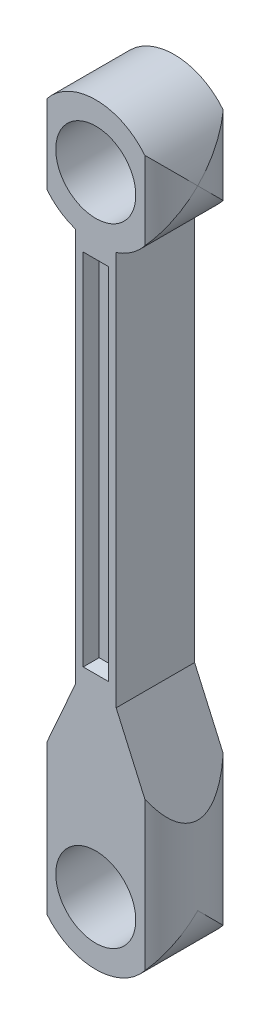
from build123d import *

# Parameters (mm, degrees)
SKETCH1_R               = 6.477
BOSS_EXTRUDE1_DEPTH     = 12.7
SKETCH2_W               = 4.064
SKETCH2_H               = 58.166
CUT_EXTRUDE1_DEPTH      = 2.032
CUT_EXTRUDE1_DRAFT      = -15
SKETCH3_W               = 4.064
SKETCH3_H               = 58.166
CUT_EXTRUDE2_DEPTH      = 2.032
CUT_EXTRUDE2_DRAFT      = -15
CUT_EXTRUDE3_DEPTH      = 113.937209103
CUT_EXTRUDE3_DEPTH_BACK = 10.16
SKETCH4_OUTSIDE_W       = 47.17
SKETCH4_OUTSIDE_H       = 39.55
SKETCH4_OUTSIDE_R       = 10.16


with BuildPart() as part:
    # Sketch1 → Boss-Extrude1 (new body)
    with BuildSketch(Plane.XY):
        with BuildLine():
            Line((-10.16, 0), (-10.16, 12.7))
            Line((-10.16, 12.7), (-3.302, 28.175956627))
            Line((-3.302, 28.175956627), (-3.302, 91.991545598))
            ThreePointArc((-3.302, 91.991545598), (0, 111.76), (3.302, 91.991545598))
            Line((3.302, 91.991545598), (3.302, 28.175956627))
            Line((3.302, 28.175956627), (10.16, 12.7))
            Line((10.16, 12.7), (10.16, 0))
            ThreePointArc((10.16, 0), (0, -10.16), (-10.16, 0))
        make_face()
        with Locations(Location((0, 0, 0), (0, 0, 180))):
            Circle(SKETCH1_R, mode=Mode.SUBTRACT)
        with Locations(Location((0, 101.6, 0), (0, 0, 180))):
            Circle(SKETCH1_R, mode=Mode.SUBTRACT)
    extrude(amount=BOSS_EXTRUDE1_DEPTH)


with BuildPart() as cut_extrude1_tool:
    # Sketch2 → Cut-Extrude1 (with draft: the straight prism first)
    with BuildSketch(Plane.XY.offset(12.7)):
        with Locations((0, 60.325)):
            Rectangle(SKETCH2_W, SKETCH2_H)
    extrude(amount=-CUT_EXTRUDE1_DEPTH)
    # Cut-Extrude1: the draft: its side faces are tilted about the plane it starts from
    cut_extrude1_sides = [cut_extrude1_tool.faces().sort_by_distance(p)[0] for p in [
        (-2.032, 60.325, 11.684),
        (0, 31.242, 11.684),
        (2.032, 60.325, 11.684),
        (0, 89.408, 11.684),
    ]]
    draft(cut_extrude1_sides, Plane.XY.offset(12.7), CUT_EXTRUDE1_DRAFT)


with BuildPart() as part_1:
    add(part.part)

    # Cut-Extrude1: cut by cut_extrude1_tool
    add(cut_extrude1_tool.part, mode=Mode.SUBTRACT)


with BuildPart() as cut_extrude2_tool:
    # Sketch3 → Cut-Extrude2 (with draft: the straight prism first)
    with BuildSketch(Plane(origin=(0, 0, 0), x_dir=(-1, 0, 0), z_dir=(0, 0, -1))):
        with Locations((0, 60.325)):
            Rectangle(SKETCH3_W, SKETCH3_H)
    extrude(amount=-CUT_EXTRUDE2_DEPTH)
    # Cut-Extrude2: the draft: its side faces are tilted about the plane it starts from
    cut_extrude2_sides = [cut_extrude2_tool.faces().sort_by_distance(p)[0] for p in [
        (2.032, 60.325, 1.016),
        (0, 31.242, 1.016),
        (-2.032, 60.325, 1.016),
        (0, 89.408, 1.016),
    ]]
    draft(cut_extrude2_sides, Plane(origin=(0, 0, 0), x_dir=(-1, 0, 0), z_dir=(0, 0, -1)), CUT_EXTRUDE2_DRAFT)


with BuildPart() as part_2:
    add(part_1.part)

    # Cut-Extrude2: cut by cut_extrude2_tool
    add(cut_extrude2_tool.part, mode=Mode.SUBTRACT)

    # Sketch4 outside → Cut-Extrude3 (cut, two sides: drawn at the far end of the back side and taken through both)
    with BuildSketch(Plane(origin=(0, 0, 0), x_dir=(1, 0, 0), z_dir=(0, 1, 0)).offset(-CUT_EXTRUDE3_DEPTH_BACK)):
        with Locations((0, -6.35)):
            Rectangle(SKETCH4_OUTSIDE_W, SKETCH4_OUTSIDE_H)
        with Locations((0, -6.35)):
            Circle(SKETCH4_OUTSIDE_R, mode=Mode.SUBTRACT)
    extrude(amount=CUT_EXTRUDE3_DEPTH + CUT_EXTRUDE3_DEPTH_BACK, mode=Mode.SUBTRACT)


solid = part_2.part
